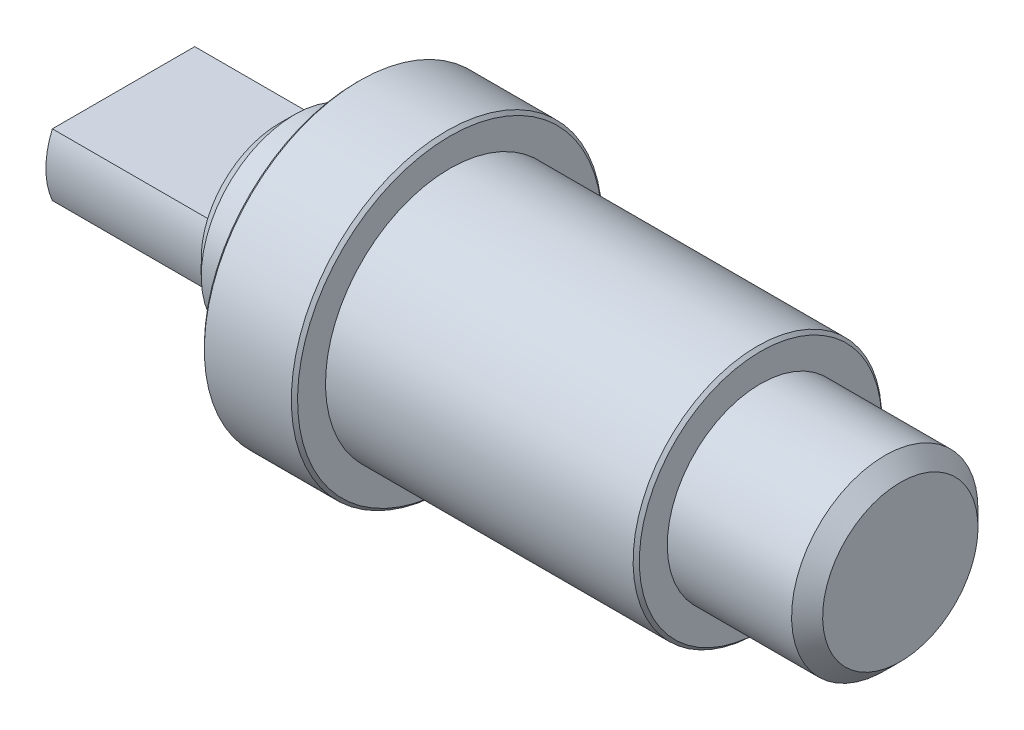
from build123d import *

# Parameters (mm, degrees)
EXTRUDE_3_DEPTH = 5


with BuildPart() as part:
    # 草图1 → 旋转1 (revolve)
    with BuildSketch(Plane.XY):
        Polygon((0, 0), (0, 2.5), (0.5, 3), (2.5, 3), (2.5, 4.9), (2.6, 5), (5.4, 5), (5.5, 4.9), (5.5, 4), (15.4, 4), (15.5, 3.9), (15.5, 3), (19.5, 3), (20, 2.5), (20, 0), align=None)
    revolve(axis=Axis((20, 0, 0), (-1, 0, 0)))

    # 草图4 → 凸台-拉伸3 (add)
    with BuildSketch(Plane(origin=(0, 0, 0), x_dir=(0, 0, -1), z_dir=(1, 0, 0))):
        with BuildLine():
            Line((0, 1), (2.291287847, 1))
            ThreePointArc((2.291287847, 1), (2.5, 0), (2.291287847, -1))
            Line((2.291287847, -1), (0, -1))
            Line((0, -1), (-2.291287847, -1))
            ThreePointArc((-2.291287847, -1), (-2.5, 0), (-2.291287847, 1))
            Line((-2.291287847, 1), (0, 1))
        make_face()
    extrude(amount=-EXTRUDE_3_DEPTH)


solid = part.part
